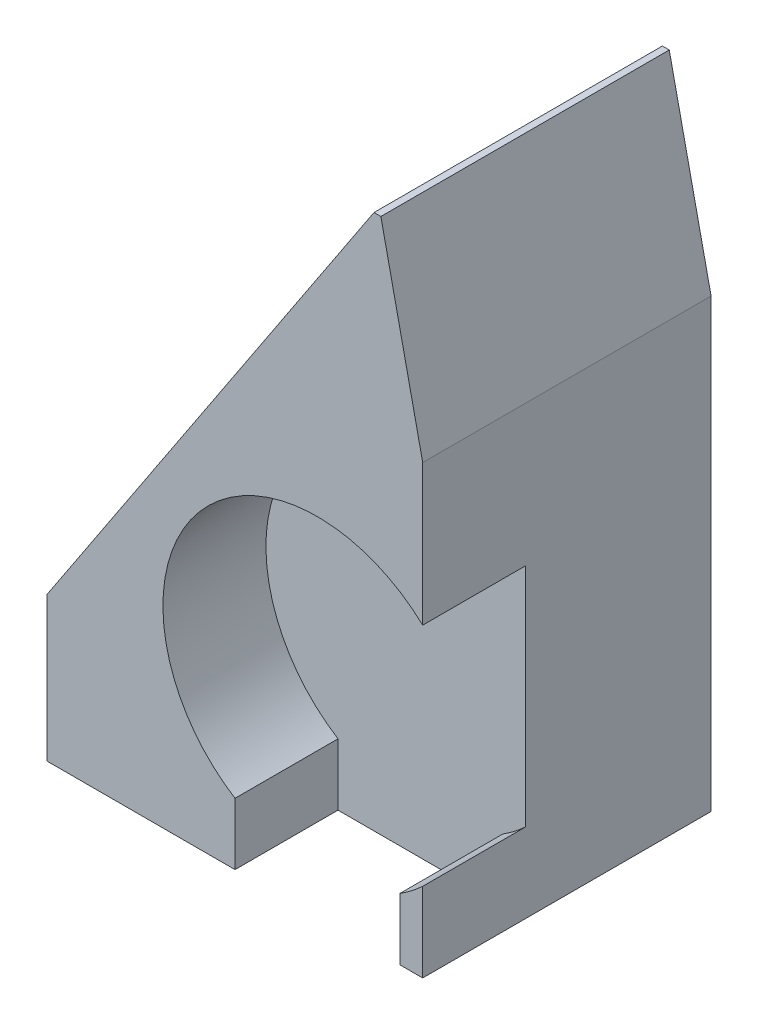
from build123d import *

# Parameters (mm, degrees)
EXTRUDE_1_DEPTH     = 70
SKETCH_3_W          = 91.211474189
SKETCH_3_H          = 70
EXTRUDE_3_DEPTH     = 20
SKETCH_7_R          = 37.5
CUT_EXTRUDE_1_DEPTH = 25
EXTRUDE_5_DEPTH     = 15


with BuildPart() as part:
    # 草图1 → 凸台-拉伸1 (new body)
    with BuildSketch(Plane.XY):
        Polygon((-88.329382669, -40.492222209), (2.88209152, -40.492222209), (2.88209152, 32.860075705), (-7.271573344, 79.507777791), (-8.937829763, 79.507777791), align=None)
    extrude(amount=EXTRUDE_1_DEPTH)

    # 草图3 → 凸台-拉伸3 (add)
    with BuildSketch(Plane.XZ.offset(40.492222209)):
        with Locations((-42.723645575, 35)):
            Rectangle(SKETCH_3_W, SKETCH_3_H)
    extrude(amount=EXTRUDE_3_DEPTH)

    # 草图7 → 切除-拉伸1 (cut)
    with BuildSketch(Plane.XY.offset(70)):
        with Locations((-22.66790848, -28.773433698)):
            Circle(SKETCH_7_R)
    extrude(amount=-CUT_EXTRUDE_1_DEPTH, mode=Mode.SUBTRACT)

    # 草图10 → 凸台-拉伸5 (add)
    with BuildSketch(Plane.XZ.offset(60.492222209)):
        Polygon((-88.329382669, 70), (-88.329382669, 0), (2.88209152, 0), (2.88209152, 70), (-2.663697539, 70), (-2.663697539, 45), (-42.672119422, 45), (-42.672119422, 70), align=None)
    extrude(amount=EXTRUDE_5_DEPTH)


solid = part.part
